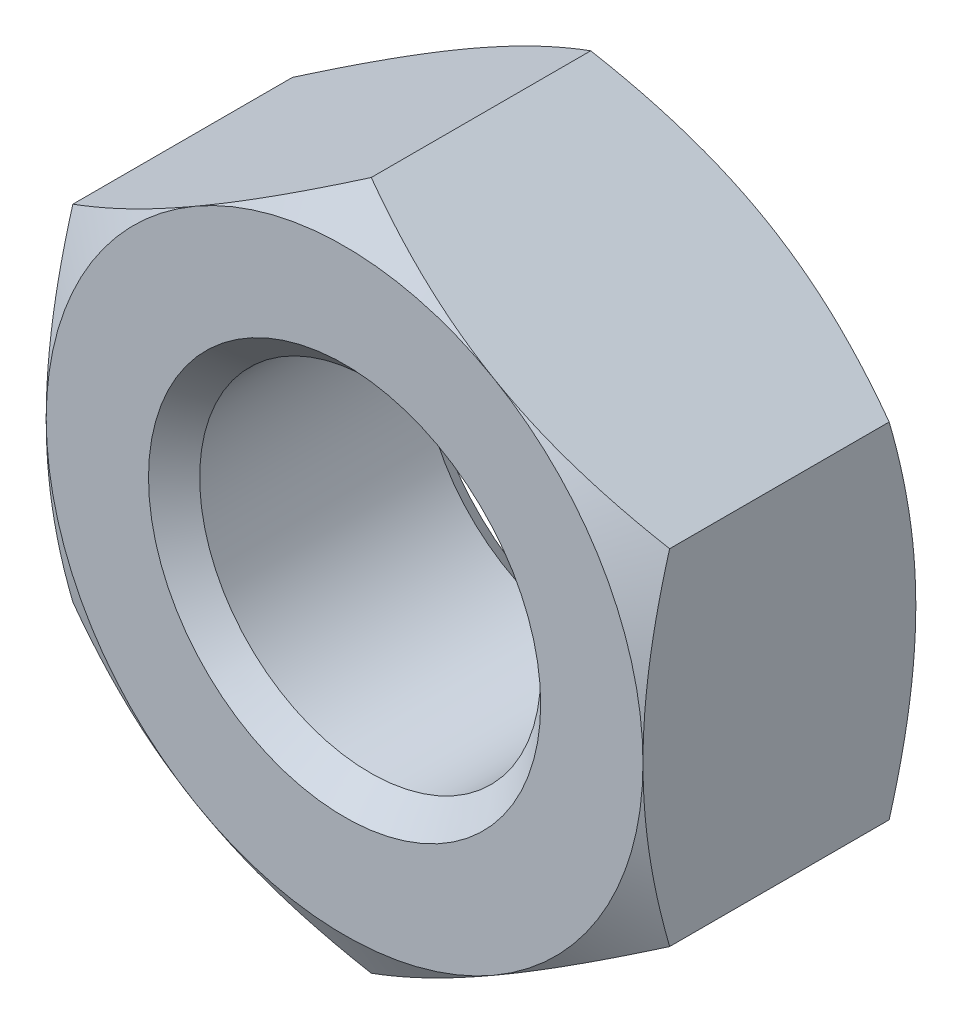
from build123d import *

# Parameters (mm, degrees)
SKETCH1_R           = 4.5
SKETCH1_R_2         = 2
BOSS_EXTRUDE1_DEPTH = 3.2
CHAMFER1_SIZE       = 1
CHAMFER1_SIZE2      = 0.577350269
CHAMFER2_SIZE       = 1
CHAMFER2_SIZE2      = 0.577350269
SKETCH1_3_R         = 4.5
CUT_EXTRUDE1_DEPTH  = 8.123201527
CHAMFER3_SIZE       = 0.3


with BuildPart() as part:
    # Sketch1 → Boss-Extrude1 (new body)
    with BuildSketch(Plane.XY):
        Circle(SKETCH1_R)
        Circle(SKETCH1_R_2, mode=Mode.SUBTRACT)
    extrude(amount=BOSS_EXTRUDE1_DEPTH)

    # Chamfer1
    chamfer1_edges = [part.edges().sort_by_distance(p)[0] for p in [
        (-4.5, 0, 3.2),
    ]]
    chamfer1_side = [part.faces().sort_by_distance(p)[0] for p in [
        (-4.372720779, 0, 3.2),
    ]]
    chamfer(chamfer1_edges, length=CHAMFER1_SIZE, length2=CHAMFER1_SIZE2, reference=chamfer1_side[0])

    # Chamfer2
    chamfer2_edges = [part.edges().sort_by_distance(p)[0] for p in [
        (-4.5, 0, 0),
    ]]
    chamfer2_side = [part.faces().sort_by_distance(p)[0] for p in [
        (-4.372720779, 0, 0),
    ]]
    chamfer(chamfer2_edges, length=CHAMFER2_SIZE, length2=CHAMFER2_SIZE2, reference=chamfer2_side[0])

    # Sketch1<3> → Cut-Extrude1 (cut, through all)
    with BuildSketch(Plane.XY):
        Circle(SKETCH1_3_R)
        Polygon((-3.5, 2.020725942), (0, 4.041451884), (3.5, 2.020725942), (3.5, -2.020725942), (0, -4.041451884), (-3.5, -2.020725942), align=None, mode=Mode.SUBTRACT)
    extrude(amount=CUT_EXTRUDE1_DEPTH, mode=Mode.SUBTRACT)

    # Chamfer3
    chamfer3_edges = [part.edges().sort_by_distance(p)[0] for p in [
        (-2, 0, 0),
        (-2, 0, 3.2),
    ]]
    chamfer(chamfer3_edges, length=CHAMFER3_SIZE)


solid = part.part
